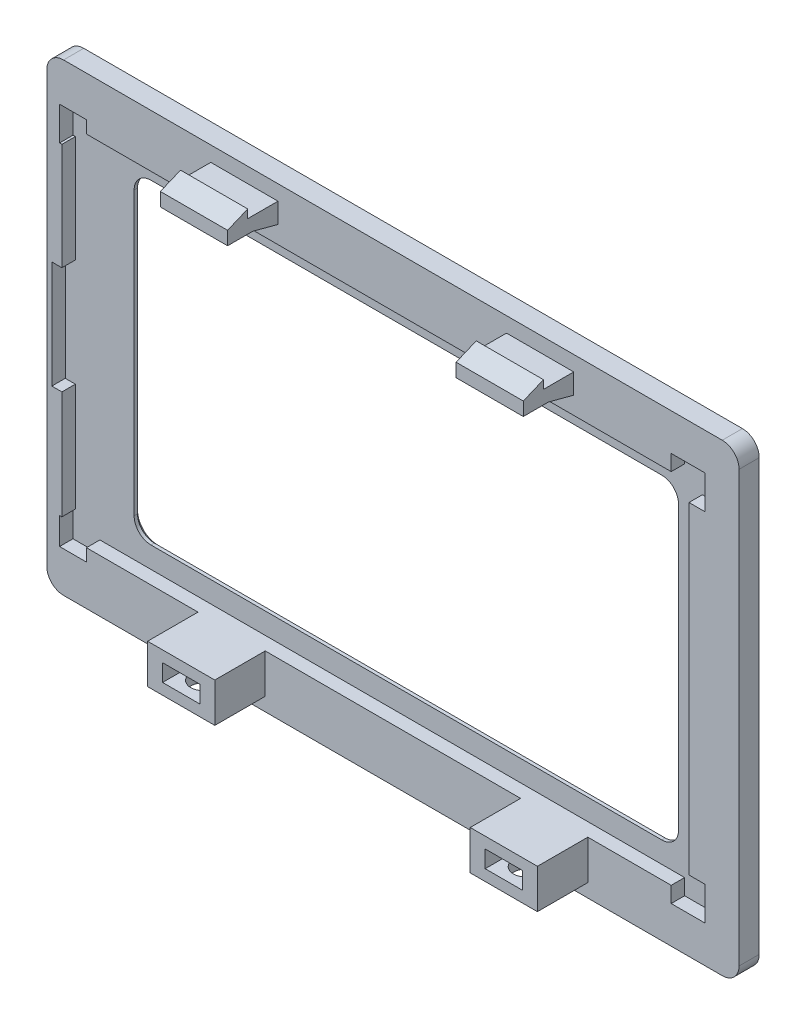
from build123d import *

# Parameters (mm, degrees)
SKETCH1_W           = 103
SKETCH1_H           = 69
BOSS_EXTRUDE1_DEPTH = 3
SKETCH2_W           = 81
SKETCH2_H           = 47
CUT_EXTRUDE1_DEPTH  = 3
CUT_EXTRUDE2_DEPTH  = 2
FILLET2_R           = 2.5
FILLET3_R           = 2.5
CHAMFER1_SIZE       = 0.5
CUT_EXTRUDE3_DEPTH  = 2
SKETCH5_W           = 10
SKETCH5_H           = 2
BOSS_EXTRUDE2_DEPTH = 7.5
SKETCH6_W           = 10
SKETCH6_H           = 5.85
BOSS_EXTRUDE3_DEPTH = 7.5
BOSS_EXTRUDE4_DEPTH = 10
BOSS_EXTRUDE5_DEPTH = 10
SKETCH9_W           = 5.55
SKETCH9_H           = 2.55
CUT_EXTRUDE4_DEPTH  = 6.5
SKETCH10_R          = 1.875
CUT_EXTRUDE5_DEPTH  = 1.65


with BuildPart() as part:
    # Sketch1 → Boss-Extrude1 (new body)
    with BuildSketch(Plane.XY):
        with Locations((62.328366078, 28.443882797)):
            Rectangle(SKETCH1_W, SKETCH1_H)
    extrude(amount=BOSS_EXTRUDE1_DEPTH)

    # Sketch2 → Cut-Extrude1 (cut)
    with BuildSketch(Plane.XY.offset(3)):
        with Locations((62.328366078, 28.443882797)):
            Rectangle(SKETCH2_W, SKETCH2_H)
    extrude(amount=-CUT_EXTRUDE1_DEPTH, mode=Mode.SUBTRACT)

    # Sketch3 → Cut-Extrude2 (cut)
    with BuildSketch(Plane.XY.offset(3)):
        Polygon((13.078366078, 55.093882797), (106.378366078, 55.093882797), (106.378366078, 1.793882797), (13.078366078, 1.793882797), (13.078366078, 20.043882797), (11.578366078, 20.043882797), (11.578366078, 36.043882797), (13.078366078, 36.043882797), align=None)
    extrude(amount=-CUT_EXTRUDE2_DEPTH, mode=Mode.SUBTRACT)

    # Fillet2
    fillet2_edges = [part.edges().sort_by_distance(p)[0] for p in [
        (113.828366078, -6.056117203, 1.5),
        (10.828366078, -6.056117203, 1.5),
        (10.828366078, 62.943882797, 1.5),
        (113.828366078, 62.943882797, 1.5),
    ]]
    fillet(fillet2_edges, radius=FILLET2_R)

    # Fillet3
    fillet3_edges = [part.edges().sort_by_distance(p)[0] for p in [
        (21.828366078, 4.943882797, 0.5),
        (21.828366078, 51.943882797, 0.5),
        (102.828366078, 51.943882797, 0.5),
        (102.828366078, 4.943882797, 0.5),
    ]]
    fillet(fillet3_edges, radius=FILLET3_R)

    # Chamfer1
    chamfer1_edges = [part.edges().sort_by_distance(p)[0] for p in [
        (22.560599125, 51.21164975, 0),
        (22.560599125, 5.676115844, 0),
        (102.096133031, 5.676115844, 0),
        (102.096133031, 51.21164975, 0),
        (21.828366078, 28.443882797, 0),
        (62.328366078, 51.943882797, 0),
        (62.328366078, 4.943882797, 0),
        (102.828366078, 28.443882797, 0),
    ]]
    chamfer(chamfer1_edges, length=CHAMFER1_SIZE)

    # Sketch4 → Cut-Extrude3 (cut)
    with BuildSketch(Plane.XY.offset(3)):
        Polygon((16.728366078, 55.093882797), (16.728366078, 56.943882797), (12.728366078, 56.943882797), (12.728366078, 51.943882797), (13.078366078, 51.943882797), (13.078366078, 55.093882797), align=None)
        Polygon((103.728366078, 55.093882797), (103.728366078, 57.443882797), (108.728366078, 57.443882797), (108.728366078, 52.443882797), (106.378366078, 52.443882797), (106.378366078, 55.093882797), align=None)
        Polygon((16.728366078, 1.793882797), (16.728366078, -0.056117203), (12.728366078, -0.056117203), (12.728366078, 3.943882797), (13.078366078, 3.943882797), (13.078366078, 1.793882797), align=None)
        Polygon((103.728366078, 1.793882797), (103.728366078, -0.556117203), (108.728366078, -0.556117203), (108.728366078, 4.443882797), (106.378366078, 4.443882797), (106.378366078, 1.793882797), align=None)
    extrude(amount=-CUT_EXTRUDE3_DEPTH, mode=Mode.SUBTRACT)

    # Sketch5 → Boss-Extrude2 (add)
    with BuildSketch(Plane.XY.offset(3)):
        with Locations((84.228366078, 59.693882797)):
            Rectangle(SKETCH5_W, SKETCH5_H)
        with Locations((40.228366078, 59.693882797)):
            Rectangle(SKETCH5_W, SKETCH5_H)
    extrude(amount=BOSS_EXTRUDE2_DEPTH)

    # Sketch6 → Boss-Extrude3 (add)
    with BuildSketch(Plane.XY.offset(3)):
        with Locations((86.328366078, -1.131117203)):
            Rectangle(SKETCH6_W, SKETCH6_H)
        with Locations((38.328366078, -1.131117203)):
            Rectangle(SKETCH6_W, SKETCH6_H)
    extrude(amount=BOSS_EXTRUDE3_DEPTH)

    # Sketch7 → Boss-Extrude4 (add)
    with BuildSketch(Plane.ZY.offset(-35.228366078)):
        Polygon((7.5, 60.693882797), (7.5, 61.943882797), (10.5, 60.693882797), align=None)
        Polygon((3, 57.693882797), (6.75, 58.693882797), (3, 58.693882797), align=None)
    extrude(amount=-BOSS_EXTRUDE4_DEPTH)

    # Sketch8 → Boss-Extrude5 (add)
    with BuildSketch(Plane.ZY.offset(-79.228366078)):
        Polygon((7.5, 60.693882797), (7.5, 61.943882797), (10.5, 60.693882797), align=None)
        Polygon((6.75, 58.693882797), (3, 58.693882797), (3, 57.693882797), align=None)
    extrude(amount=-BOSS_EXTRUDE5_DEPTH)

    # Sketch9 → Cut-Extrude4 (cut)
    with BuildSketch(Plane.XY.offset(10.5)):
        with Locations((86.328366078, -1.131117203)):
            Rectangle(SKETCH9_W, SKETCH9_H)
        with Locations((38.328366078, -1.131117203)):
            Rectangle(SKETCH9_W, SKETCH9_H)
    extrude(amount=-CUT_EXTRUDE4_DEPTH, mode=Mode.SUBTRACT)

    # Sketch10 → Cut-Extrude5 (cut)
    with BuildSketch(Plane.XZ.offset(4.056117203)):
        with Locations(Location((38.328366078, 7.2, 0), (0, 0, 270))):
            Circle(SKETCH10_R)
        with Locations(Location((86.328366078, 7.2, 0), (0, 0, 270))):
            Circle(SKETCH10_R)
    extrude(amount=-CUT_EXTRUDE5_DEPTH, mode=Mode.SUBTRACT)


solid = part.part
